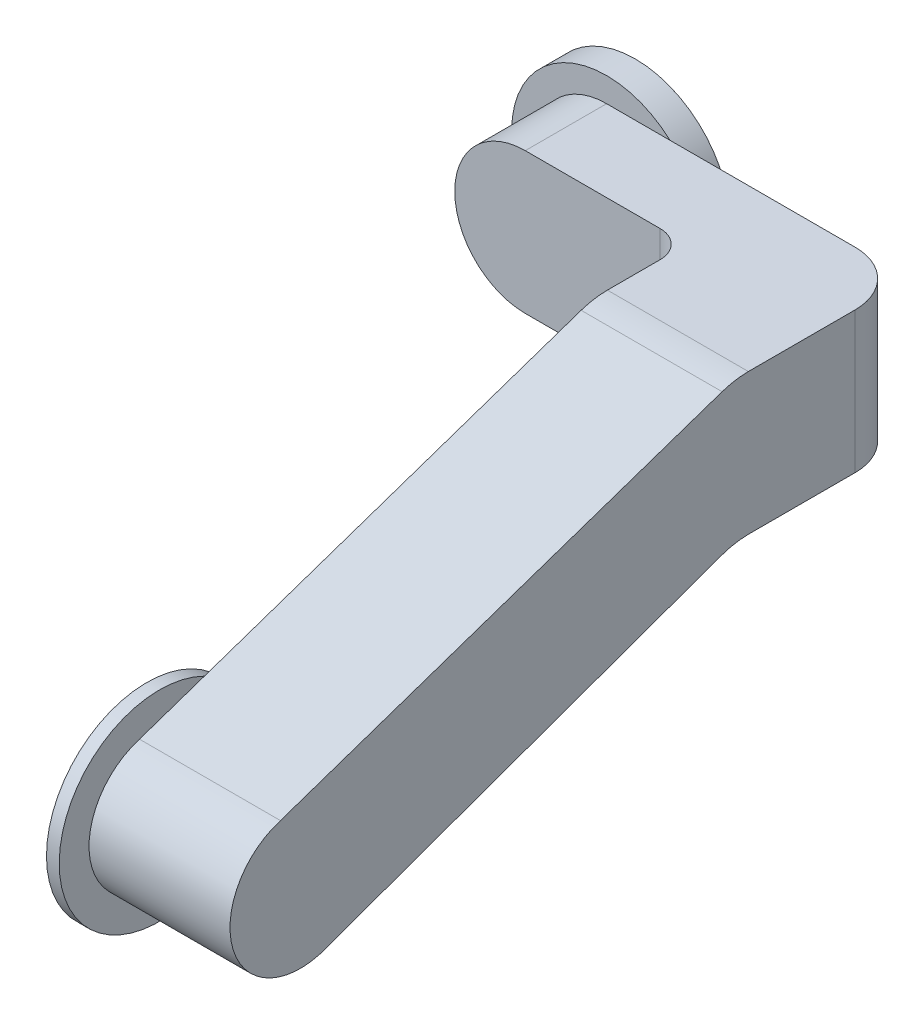
from build123d import *

# Parameters (mm, degrees)
SKETCH2_R           = 44.45
BOSS_EXTRUDE1_DEPTH = 13.462
BOSS_EXTRUDE2_DEPTH = 38.1
SKETCH4_W           = 38.1
SKETCH4_H           = 66.04
BOSS_EXTRUDE3_DEPTH = 141.859
SKETCH5_W           = 66.04
SKETCH5_H           = 66.04
BOSS_EXTRUDE4_DEPTH = 43.6626
FILLET1_R           = 25.4
FILLET2_R           = 12.7
FILLET4_R           = 38.1
BOSS_EXTRUDE5_DEPTH = 66.04
SKETCH12_R          = 46.99
BOSS_EXTRUDE6_DEPTH = 5.969


with BuildPart() as part:
    # Sketch2 → Boss-Extrude1 (new body)
    with BuildSketch(Plane.XY):
        Circle(SKETCH2_R)
    extrude(amount=BOSS_EXTRUDE1_DEPTH)

    # Sketch3 → Boss-Extrude2 (add)
    with BuildSketch(Plane.XY.offset(13.462)):
        with BuildLine():
            Line((0, 33.02), (0, -33.02))
            ThreePointArc((0, -33.02), (-33.02, 0), (0, 33.02))
        make_face()
    extrude(amount=BOSS_EXTRUDE2_DEPTH)

    # Sketch4 → Boss-Extrude3 (add)
    with BuildSketch(Plane(origin=(0, 0, 0), x_dir=(0, 0, -1), z_dir=(1, 0, 0))):
        with Locations((-32.512, 0)):
            Rectangle(SKETCH4_W, SKETCH4_H)
    extrude(amount=BOSS_EXTRUDE3_DEPTH)

    # Sketch5 → Boss-Extrude4 (add)
    with BuildSketch(Plane(origin=(0, 18.542, 51.562), x_dir=(1, 0, 0), z_dir=(0, 0, -1))):
        with Locations((108.839, 18.542)):
            Rectangle(SKETCH5_W, SKETCH5_H)
    extrude(amount=-BOSS_EXTRUDE4_DEPTH)

    # Fillet1
    fillet1_edges = [part.edges().sort_by_distance(p)[0] for p in [
        (141.859, 0, 13.462),
    ]]
    fillet(fillet1_edges, radius=FILLET1_R)

    # Fillet2
    fillet2_edges = [part.edges().sort_by_distance(p)[0] for p in [
        (75.819, 0, 51.562),
    ]]
    fillet(fillet2_edges, radius=FILLET2_R)

    # Sketch8 → Loft1 section 0
    with BuildSketch(Plane(origin=(0, 0, 95.2246), x_dir=(0, -1, 0), z_dir=(0, 0, 1))):
        with BuildLine():
            Line((-33.02, 75.819), (33.02, 75.819))
            Line((33.02, 75.819), (33.02, 141.859))
            Line((33.02, 141.859), (-33.02, 141.859))
            Line((-33.02, 141.859), (-33.02, 75.819))
        make_face()
    # Sketch10 → Loft1 section 1
    with BuildSketch(Plane(origin=(0, -87.20411689, 293.962783253), x_dir=(-1, 0, 0), z_dir=(0, -0.2844002167201493, 0.958705646551397))):
        with BuildLine():
            Line((-141.859, 16.349067741), (-75.819, 16.349067741))
            Line((-75.819, 16.349067741), (-75.819, -49.690932259))
            Line((-75.819, -49.690932259), (-141.859, -49.690932259))
            Line((-141.859, -49.690932259), (-141.859, 16.349067741))
        make_face()
    loft()

    # Fillet4
    fillet4_edges = [part.edges().sort_by_distance(p)[0] for p in [
        (108.839, 33.02, 95.2246),
        (108.839, -33.02, 95.2246),
    ]]
    fillet(fillet4_edges, radius=FILLET4_R)

    # Sketch11 → Boss-Extrude5 (add)
    with BuildSketch(Plane(origin=(141.859, 0, 0), x_dir=(0, 0, -1), z_dir=(1, 0, 0))):
        with BuildLine():
            Line((-308.094895156, -39.565139551), (-289.313104844, -102.878060449))
            ThreePointArc((-289.313104844, -102.878060449), (-330.360460449, -80.612495156), (-308.094895156, -39.565139551))
        make_face()
    extrude(amount=-BOSS_EXTRUDE5_DEPTH)

    # Sketch12 → Boss-Extrude6 (add)
    with BuildSketch(Plane.ZY.offset(-75.819)):
        with Locations((298.704, -71.2216)):
            Circle(SKETCH12_R)
    extrude(amount=BOSS_EXTRUDE6_DEPTH)


solid = part.part
